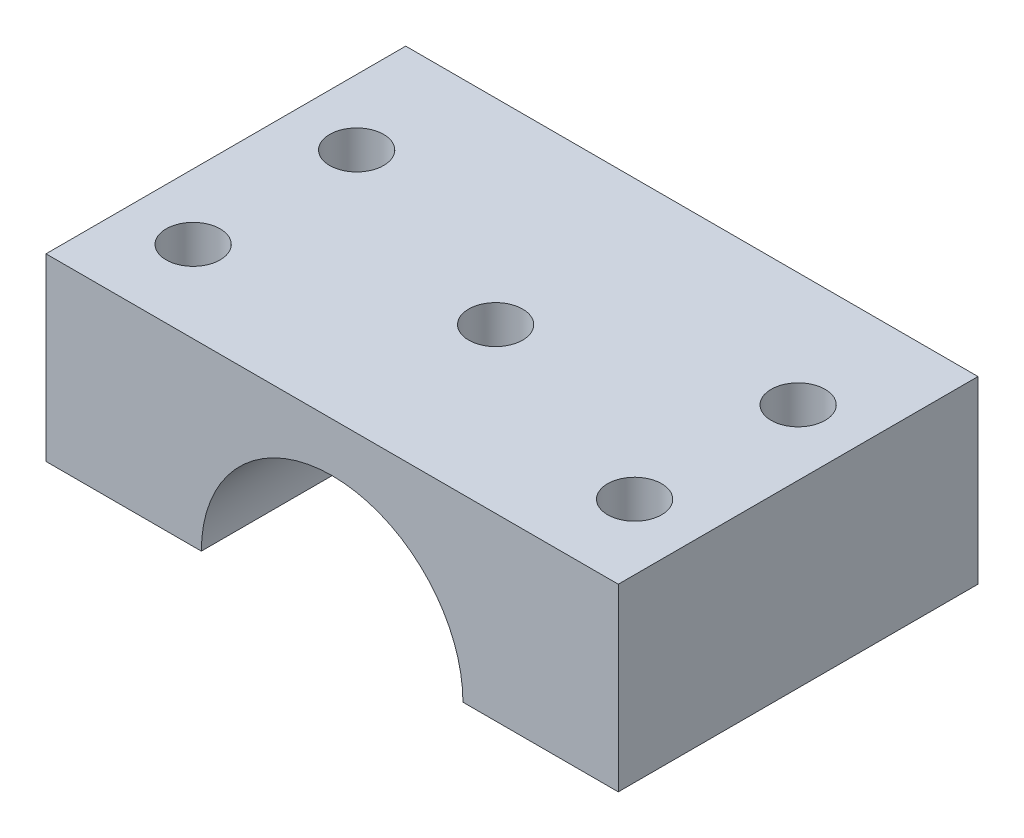
from build123d import *

# Parameters (mm, degrees)
EXTRUDE_1_DEPTH     = 22
SKETCH_3_R          = 1.65
CUT_EXTRUDE_2_DEPTH = 19
EXTRUDE_2_DEPTH     = 2
SKETCH_5_R          = 1.65
CUT_EXTRUDE_3_DEPTH = 31.186917806


with BuildPart() as part:
    # 草图1 → 凸台-拉伸1 (new body)
    with BuildSketch(Plane.XY):
        with BuildLine():
            Line((-10.583005244, 3), (-17.5, 3))
            Line((-17.5, 3), (-17.5, 0))
            Line((-17.5, 0), (-11, 0))
            ThreePointArc((-11, 0), (-10.895252583, 1.514421063), (-10.583005244, 3))
        make_face()
        with BuildLine():
            Line((-7.416198487, 3), (-10.583005244, 3))
            ThreePointArc((-10.583005244, 3), (-10.895252583, 1.514421063), (-11, 0))
            Line((-11, 0), (-8, 0))
            ThreePointArc((-8, 0), (-7.85269342, 1.5281381), (-7.416198487, 3))
        make_face()
        with BuildLine():
            ThreePointArc((11, 0), (10.895252583, 1.514421063), (10.583005244, 3))
            Line((10.583005244, 3), (7.416198487, 3))
            ThreePointArc((7.416198487, 3), (7.85269342, 1.5281381), (8, 0))
            Line((8, 0), (11, 0))
        make_face()
        with BuildLine():
            ThreePointArc((-4.5e-08, 11), (-6.633249599, 8.774964374), (-10.583005244, 3))
            Line((-10.583005244, 3), (-7.416198487, 3))
            ThreePointArc((-7.416198487, 3), (0, 8), (7.416198487, 3))
            Line((7.416198487, 3), (10.583005244, 3))
            ThreePointArc((10.583005244, 3), (6.633249563, 8.774964401), (-4.5e-08, 11))
        make_face()
        with BuildLine():
            Line((17.5, 3), (10.583005244, 3))
            ThreePointArc((10.583005244, 3), (10.895252583, 1.514421063), (11, 0))
            Line((11, 0), (17.5, 0))
            Line((17.5, 0), (17.5, 3))
        make_face()
        with BuildLine():
            Line((-17.5, 11), (-17.5, 3))
            Line((-17.5, 3), (-10.583005244, 3))
            ThreePointArc((-10.583005244, 3), (-6.633249599, 8.774964374), (-4.5e-08, 11))
            Line((-4.5e-08, 11), (-17.5, 11))
        make_face()
        with BuildLine():
            Line((17.5, 11), (-4.5e-08, 11))
            ThreePointArc((-4.5e-08, 11), (6.633249563, 8.774964401), (10.583005244, 3))
            Line((10.583005244, 3), (17.5, 3))
            Line((17.5, 3), (17.5, 11))
        make_face()
    extrude(amount=EXTRUDE_1_DEPTH)

    # 草图3 → 切除-拉伸2 (cut)
    with BuildSketch(Plane(origin=(0, 0, 0), x_dir=(1, 0, 0), z_dir=(0, 1, 0))):
        with Locations(Location((0, -12, 0), (0, 0, 90))):
            Circle(SKETCH_3_R)
    extrude(amount=CUT_EXTRUDE_2_DEPTH, mode=Mode.SUBTRACT)

    # 草图4 → 凸台-拉伸2 (add)
    with BuildSketch(Plane(origin=(0, 0, 0), x_dir=(-1, 0, 0), z_dir=(0, 0, -1))):
        with BuildLine():
            Line((-11, 0), (11, 0))
            ThreePointArc((11, 0), (0, 11), (-11, 0))
        make_face()
    extrude(amount=-EXTRUDE_2_DEPTH)

    # 草图5 → 切除-拉伸3 (cut, through all)
    with BuildSketch(Plane.XZ):
        with Locations((-13.5, 17)):
            Circle(SKETCH_5_R)
        with Locations((-13.5, 7)):
            Circle(SKETCH_5_R)
        with Locations((13.5, 17)):
            Circle(SKETCH_5_R)
        with Locations((13.5, 7)):
            Circle(SKETCH_5_R)
    extrude(amount=-CUT_EXTRUDE_3_DEPTH, mode=Mode.SUBTRACT)


solid = part.part
